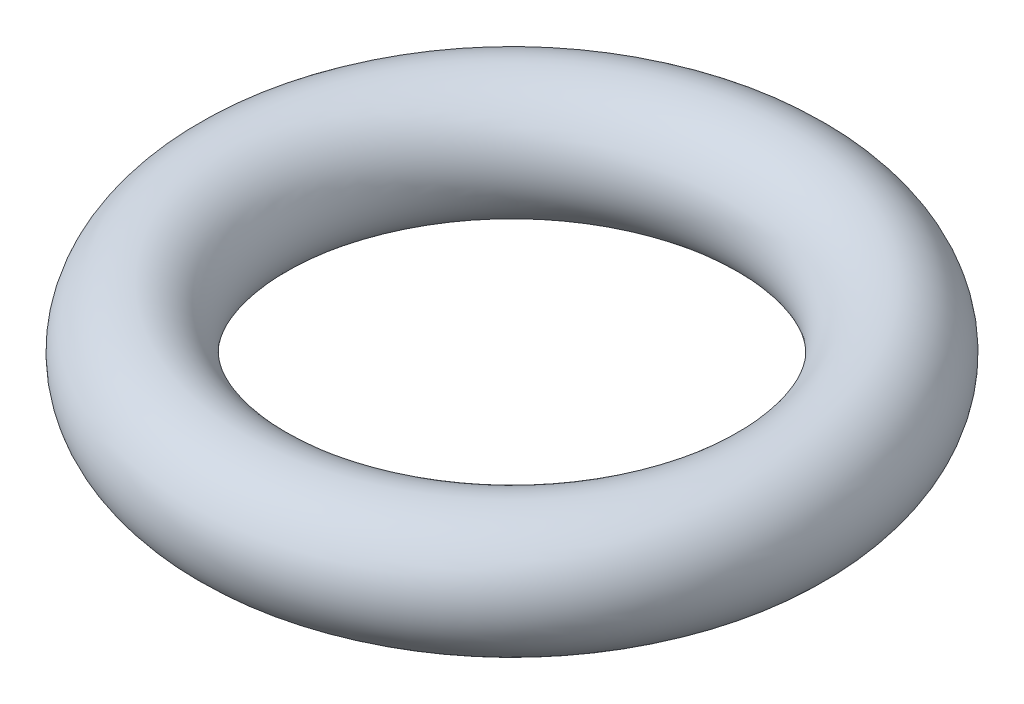
from build123d import *

# Parameters (mm, degrees)
CROQUIS1_R = 0.89


with BuildPart() as part:
    # Croquis1 → Revolución1 (revolve)
    with BuildSketch(Plane(origin=(0, 0, 0), x_dir=(0, 0, -1), z_dir=(1, 0, 0))):
        Circle(CROQUIS1_R)
    revolve(axis=Axis((0, 6.812578265, 3.925), (0, -1, 0)))


solid = part.part
